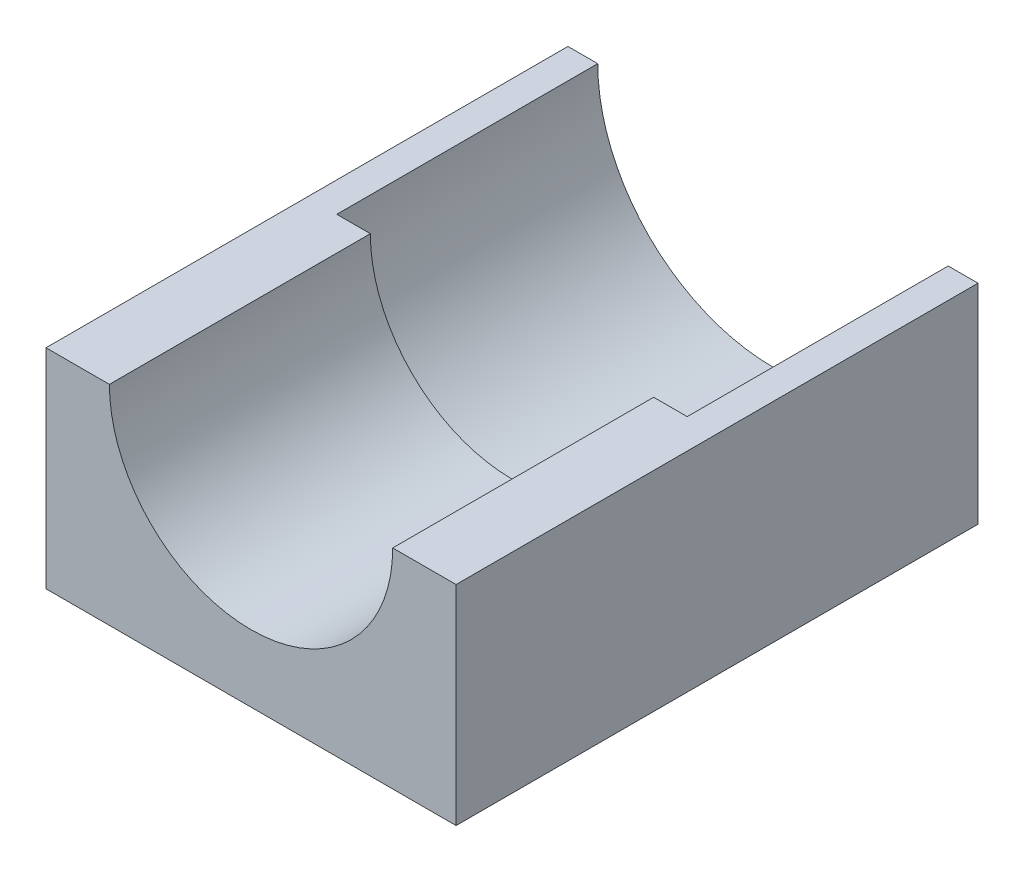
from build123d import *

# Parameters (mm, degrees)
BOSS_EXTRUDE1_DEPTH = 35
BOSS_EXTRUDE2_DEPTH = 35


with BuildPart() as part:
    # Sketch2 → Boss-Extrude1 (new body)
    with BuildSketch(Plane.XY):
        with BuildLine():
            Line((48.748941829, 15.932254861), (44.748941829, 15.932254861))
            Line((44.748941829, 15.932254861), (44.748941829, -12.067745139))
            Line((44.748941829, -12.067745139), (99.748941829, -12.067745139))
            Line((99.748941829, -12.067745139), (99.748941829, 15.932254861))
            Line((99.748941829, 15.932254861), (95.748941829, 15.932254861))
            ThreePointArc((95.748941829, 15.932254861), (72.248941829, -7.567745139), (48.748941829, 15.932254861))
        make_face()
    extrude(amount=BOSS_EXTRUDE1_DEPTH)

    # Sketch3 → Boss-Extrude2 (add)
    with BuildSketch(Plane.XY.offset(35)):
        with BuildLine():
            Line((91.248941829, 15.932254861), (99.748941829, 15.932254861))
            Line((99.748941829, 15.932254861), (99.748941829, -12.067745139))
            Line((99.748941829, -12.067745139), (44.748941829, -12.067745139))
            Line((44.748941829, -12.067745139), (44.748941829, 15.932254861))
            Line((44.748941829, 15.932254861), (53.248941829, 15.932254861))
            ThreePointArc((53.248941829, 15.932254861), (72.248941829, -3.067745139), (91.248941829, 15.932254861))
        make_face()
    extrude(amount=BOSS_EXTRUDE2_DEPTH)


solid = part.part
